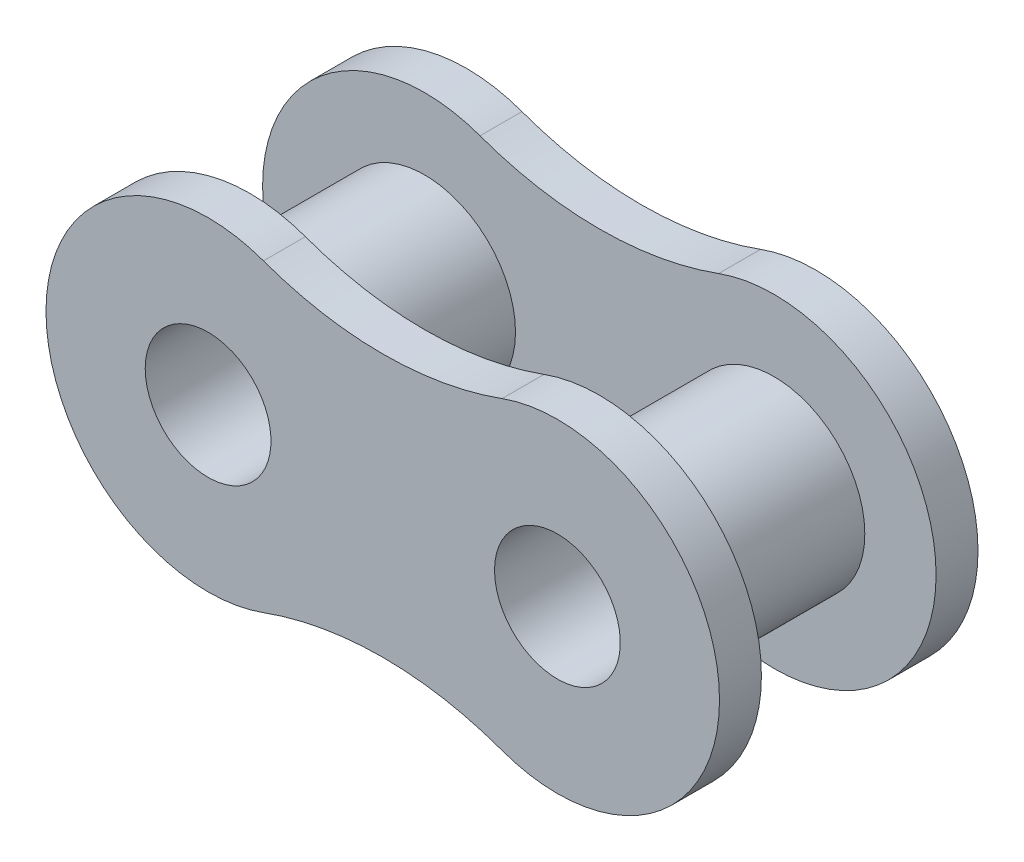
from build123d import *

# Parameters (mm, degrees)
INNER_START         = 1.5875
SKETCH1_R           = 1.143
INNER_LINK_S1_DEPTH = 0.762
TUBES_START         = 3.175
SKETCH3_R           = 1.651
SKETCH3_R_2         = 1.143
TUBES_DEPTH         = 3.175


with BuildPart() as part:
    # Sketch1 → inner link s1 (new body)
    with BuildSketch(Plane.XY.offset(INNER_START)):
        with BuildLine():
            ThreePointArc((-1.006284153, -2.769235484), (2.9464, 0), (-1.006284153, 2.769235484))
            ThreePointArc((-1.006284153, 2.769235484), (-3.175, 2.387415405), (-5.343715847, 2.769235484))
            ThreePointArc((-5.343715847, 2.769235484), (-9.2964, 0), (-5.343715847, -2.769235484))
            ThreePointArc((-5.343715847, -2.769235484), (-3.175, -2.387415405), (-1.006284153, -2.769235484))
        make_face()
        with Locations(Location((0, 0, 0), (0, 0, 180))):
            Circle(SKETCH1_R, mode=Mode.SUBTRACT)
        with Locations(Location((-6.35, 0, 0), (0, 0, 180))):
            Circle(SKETCH1_R, mode=Mode.SUBTRACT)
    extrude(amount=INNER_LINK_S1_DEPTH)


with BuildPart() as body_2:
    # inner link s2: mirrored copy
    add(part.part.mirror(Plane.XY))


with BuildPart() as part_1:
    add(part.part)

    add(body_2.part)  # tubes merges body 2
    # Sketch3 → tubes (add)
    # profile 1 of 2: a face of its own
    with BuildSketch(Plane(origin=(0, 0, 1.5875), x_dir=(-1, 0, 0), z_dir=(0, 0, -1)).offset(TUBES_START)):
        with Locations(Location((0, 0, 0), (0, 0, 180))):
            Circle(SKETCH3_R)
        Circle(SKETCH3_R_2, mode=Mode.SUBTRACT)
    # profile 2 of 2: a face of its own
    with BuildSketch(Plane(origin=(0, 0, 1.5875), x_dir=(-1, 0, 0), z_dir=(0, 0, -1)).offset(TUBES_START)):
        with Locations(Location((6.35, 0, 0), (0, 0, 180))):
            Circle(SKETCH3_R)
        with Locations((6.35, 0)):
            Circle(SKETCH3_R_2, mode=Mode.SUBTRACT)
    extrude(amount=-TUBES_DEPTH)


solid = part_1.part
